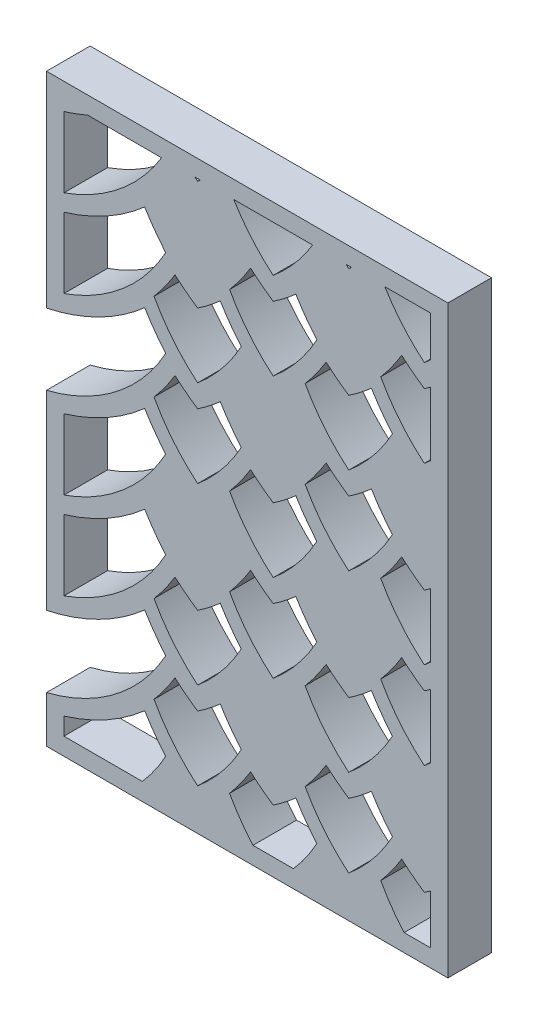
from build123d import *

# Parameters (mm, degrees)
SKETCH3_W           = 44
SKETCH3_H           = 63
BOSS_EXTRUDE1_DEPTH = 5
CUT_EXTRUDE2_DEPTH  = 97.338494284
SKETCH4_W           = 44
SKETCH4_H           = 2
BOSS_EXTRUDE2_DEPTH = 5
SKETCH5_W           = 2
SKETCH5_H           = 3.648110673
SKETCH5_H_2         = 19.321036692
SKETCH5_H_3         = 20.040143185
BOSS_EXTRUDE3_DEPTH = 5


with BuildPart() as part:
    # Sketch3 → Boss-Extrude1 (new body)
    with BuildSketch(Plane.XY):
        with Locations((22, 54.057614979)):
            Rectangle(SKETCH3_W, SKETCH3_H)
    extrude(amount=BOSS_EXTRUDE1_DEPTH)

    # Sketch2 → Cut-Extrude2 (cut, through all)
    with BuildSketch(Plane.XY):
        with BuildLine():
            ThreePointArc((17.320508076, 5.287997478), (14.53811499, 8.101888513), (12.320449347, 11.379334643))
            ThreePointArc((12.320449347, 11.379334643), (13.592770843, 12.995597857), (14.726377387, 14.712002522))
            ThreePointArc((14.726377387, 14.712002522), (15.990223335, 13.667427809), (17.320508076, 12.708894857))
            ThreePointArc((17.320508076, 12.708894857), (18.650792816, 13.667427809), (19.914638764, 14.712002522))
            ThreePointArc((19.914638764, 14.712002522), (21.048245308, 12.995597857), (22.320566805, 11.379334643))
            ThreePointArc((22.320566805, 11.379334643), (20.102901162, 8.101888513), (17.320508076, 5.287997478))
        make_face()
        with BuildLine():
            ThreePointArc((25.980762114, 10.287997478), (23.198369028, 13.101888513), (20.980703384, 16.379334643))
            ThreePointArc((20.980703384, 16.379334643), (22.253024881, 17.995597857), (23.386631425, 19.712002522))
            ThreePointArc((23.386631425, 19.712002522), (24.650477373, 18.667427809), (25.980762114, 17.708894857))
            ThreePointArc((25.980762114, 17.708894857), (27.311046854, 18.667427809), (28.574892802, 19.712002522))
            ThreePointArc((28.574892802, 19.712002522), (29.708499346, 17.995597857), (30.980820843, 16.379334643))
            ThreePointArc((30.980820843, 16.379334643), (28.763155199, 13.101888513), (25.980762114, 10.287997478))
        make_face()
        with BuildLine():
            ThreePointArc((43.301270189, 20.287997478), (40.518877103, 23.101888513), (38.30121146, 26.379334643))
            ThreePointArc((38.30121146, 26.379334643), (39.573532957, 27.995597857), (40.7071395, 29.712002522))
            ThreePointArc((40.7071395, 29.712002522), (41.970985448, 28.667427809), (43.301270189, 27.708894857))
            ThreePointArc((43.301270189, 27.708894857), (44.63155493, 28.667427809), (45.895400878, 29.712002522))
            ThreePointArc((45.895400878, 29.712002522), (47.029007421, 27.995597857), (48.301328918, 26.379334643))
            ThreePointArc((48.301328918, 26.379334643), (46.083663275, 23.101888513), (43.301270189, 20.287997478))
        make_face()
        with BuildLine():
            ThreePointArc((51.961524227, 25.287997478), (49.179131141, 28.101888513), (46.961465498, 31.379334643))
            ThreePointArc((46.961465498, 31.379334643), (48.233786995, 32.995597857), (49.367393538, 34.712002522))
            ThreePointArc((49.367393538, 34.712002522), (50.631239486, 33.667427809), (51.961524227, 32.708894857))
            ThreePointArc((51.961524227, 32.708894857), (53.291808968, 33.667427809), (54.555654916, 34.712002522))
            ThreePointArc((54.555654916, 34.712002522), (55.689261459, 32.995597857), (56.961582956, 31.379334643))
            ThreePointArc((56.961582956, 31.379334643), (54.743917313, 28.101888513), (51.961524227, 25.287997478))
        make_face()
        with BuildLine():
            ThreePointArc((25.980762114, 20.287997478), (23.198369028, 23.101888513), (20.980703384, 26.379334643))
            ThreePointArc((20.980703384, 26.379334643), (22.253024881, 27.995597857), (23.386631425, 29.712002522))
            ThreePointArc((23.386631425, 29.712002522), (24.650477373, 28.667427809), (25.980762114, 27.708894857))
            ThreePointArc((25.980762114, 27.708894857), (27.311046854, 28.667427809), (28.574892802, 29.712002522))
            ThreePointArc((28.574892802, 29.712002522), (29.708499346, 27.995597857), (30.980820843, 26.379334643))
            ThreePointArc((30.980820843, 26.379334643), (28.763155199, 23.101888513), (25.980762114, 20.287997478))
        make_face()
        with BuildLine():
            ThreePointArc((34.641016151, 25.287997478), (31.858623065, 28.101888513), (29.640957422, 31.379334643))
            ThreePointArc((29.640957422, 31.379334643), (30.913278919, 32.995597857), (32.046885463, 34.712002522))
            ThreePointArc((32.046885463, 34.712002522), (33.310731411, 33.667427809), (34.641016151, 32.708894857))
            ThreePointArc((34.641016151, 32.708894857), (35.971300892, 33.667427809), (37.23514684, 34.712002522))
            ThreePointArc((37.23514684, 34.712002522), (38.368753384, 32.995597857), (39.64107488, 31.379334643))
            ThreePointArc((39.64107488, 31.379334643), (37.423409237, 28.101888513), (34.641016151, 25.287997478))
        make_face()
        with BuildLine():
            ThreePointArc((51.961524227, 35.287997478), (49.179131141, 38.101888513), (46.961465498, 41.379334643))
            ThreePointArc((46.961465498, 41.379334643), (48.233786995, 42.995597857), (49.367393538, 44.712002522))
            ThreePointArc((49.367393538, 44.712002522), (50.631239486, 43.667427809), (51.961524227, 42.708894857))
            ThreePointArc((51.961524227, 42.708894857), (53.291808968, 43.667427809), (54.555654916, 44.712002522))
            ThreePointArc((54.555654916, 44.712002522), (55.689261459, 42.995597857), (56.961582956, 41.379334643))
            ThreePointArc((56.961582956, 41.379334643), (54.743917313, 38.101888513), (51.961524227, 35.287997478))
        make_face()
        with BuildLine():
            ThreePointArc((60.621778265, 40.287997478), (57.839385179, 43.101888513), (55.621719536, 46.379334643))
            ThreePointArc((55.621719536, 46.379334643), (56.894041033, 47.995597857), (58.027647576, 49.712002522))
            ThreePointArc((58.027647576, 49.712002522), (59.291493524, 48.667427809), (60.621778265, 47.708894857))
            ThreePointArc((60.621778265, 47.708894857), (61.952063006, 48.667427809), (63.215908954, 49.712002522))
            ThreePointArc((63.215908954, 49.712002522), (64.349515497, 47.995597857), (65.621836994, 46.379334643))
            ThreePointArc((65.621836994, 46.379334643), (63.404171351, 43.101888513), (60.621778265, 40.287997478))
        make_face()
        with BuildLine():
            ThreePointArc((17.320508076, 25.287997478), (14.53811499, 28.101888513), (12.320449347, 31.379334643))
            ThreePointArc((12.320449347, 31.379334643), (13.592770843, 32.995597857), (14.726377387, 34.712002522))
            ThreePointArc((14.726377387, 34.712002522), (15.990223335, 33.667427809), (17.320508076, 32.708894857))
            ThreePointArc((17.320508076, 32.708894857), (18.650792816, 33.667427809), (19.914638764, 34.712002522))
            ThreePointArc((19.914638764, 34.712002522), (21.048245308, 32.995597857), (22.320566805, 31.379334643))
            ThreePointArc((22.320566805, 31.379334643), (20.102901162, 28.101888513), (17.320508076, 25.287997478))
        make_face()
        with BuildLine():
            ThreePointArc((34.641016151, 35.287997478), (31.858623065, 38.101888513), (29.640957422, 41.379334643))
            ThreePointArc((29.640957422, 41.379334643), (30.913278919, 42.995597857), (32.046885463, 44.712002522))
            ThreePointArc((32.046885463, 44.712002522), (33.310731411, 43.667427809), (34.641016151, 42.708894857))
            ThreePointArc((34.641016151, 42.708894857), (35.971300892, 43.667427809), (37.23514684, 44.712002522))
            ThreePointArc((37.23514684, 44.712002522), (38.368753384, 42.995597857), (39.64107488, 41.379334643))
            ThreePointArc((39.64107488, 41.379334643), (37.423409237, 38.101888513), (34.641016151, 35.287997478))
        make_face()
        with BuildLine():
            ThreePointArc((43.301270189, 40.287997478), (40.518877103, 43.101888513), (38.30121146, 46.379334643))
            ThreePointArc((38.30121146, 46.379334643), (39.573532957, 47.995597857), (40.7071395, 49.712002522))
            ThreePointArc((40.7071395, 49.712002522), (41.970985448, 48.667427809), (43.301270189, 47.708894857))
            ThreePointArc((43.301270189, 47.708894857), (44.63155493, 48.667427809), (45.895400878, 49.712002522))
            ThreePointArc((45.895400878, 49.712002522), (47.029007421, 47.995597857), (48.301328918, 46.379334643))
            ThreePointArc((48.301328918, 46.379334643), (46.083663275, 43.101888513), (43.301270189, 40.287997478))
        make_face()
        with BuildLine():
            ThreePointArc((60.621778265, 50.287997478), (57.839385179, 53.101888513), (55.621719536, 56.379334643))
            ThreePointArc((55.621719536, 56.379334643), (56.894041033, 57.995597857), (58.027647576, 59.712002522))
            ThreePointArc((58.027647576, 59.712002522), (59.291493524, 58.667427809), (60.621778265, 57.708894857))
            ThreePointArc((60.621778265, 57.708894857), (61.952063006, 58.667427809), (63.215908954, 59.712002522))
            ThreePointArc((63.215908954, 59.712002522), (64.349515497, 57.995597857), (65.621836994, 56.379334643))
            ThreePointArc((65.621836994, 56.379334643), (63.404171351, 53.101888513), (60.621778265, 50.287997478))
        make_face()
        with BuildLine():
            ThreePointArc((17.320508076, 35.287997478), (14.53811499, 38.101888513), (12.320449347, 41.379334643))
            ThreePointArc((12.320449347, 41.379334643), (13.592770843, 42.995597857), (14.726377387, 44.712002522))
            ThreePointArc((14.726377387, 44.712002522), (15.990223335, 43.667427809), (17.320508076, 42.708894857))
            ThreePointArc((17.320508076, 42.708894857), (18.650792816, 43.667427809), (19.914638764, 44.712002522))
            ThreePointArc((19.914638764, 44.712002522), (21.048245308, 42.995597857), (22.320566805, 41.379334643))
            ThreePointArc((22.320566805, 41.379334643), (20.102901162, 38.101888513), (17.320508076, 35.287997478))
        make_face()
        with BuildLine():
            ThreePointArc((25.980762114, 40.287997478), (23.198369028, 43.101888513), (20.980703384, 46.379334643))
            ThreePointArc((20.980703384, 46.379334643), (22.253024881, 47.995597857), (23.386631425, 49.712002522))
            ThreePointArc((23.386631425, 49.712002522), (24.650477373, 48.667427809), (25.980762114, 47.708894857))
            ThreePointArc((25.980762114, 47.708894857), (27.311046854, 48.667427809), (28.574892802, 49.712002522))
            ThreePointArc((28.574892802, 49.712002522), (29.708499346, 47.995597857), (30.980820843, 46.379334643))
            ThreePointArc((30.980820843, 46.379334643), (28.763155199, 43.101888513), (25.980762114, 40.287997478))
        make_face()
        with BuildLine():
            ThreePointArc((43.301270189, 50.287997478), (40.518877103, 53.101888513), (38.30121146, 56.379334643))
            ThreePointArc((38.30121146, 56.379334643), (39.573532957, 57.995597857), (40.7071395, 59.712002522))
            ThreePointArc((40.7071395, 59.712002522), (41.970985448, 58.667427809), (43.301270189, 57.708894857))
            ThreePointArc((43.301270189, 57.708894857), (44.63155493, 58.667427809), (45.895400878, 59.712002522))
            ThreePointArc((45.895400878, 59.712002522), (47.029007421, 57.995597857), (48.301328918, 56.379334643))
            ThreePointArc((48.301328918, 56.379334643), (46.083663275, 53.101888513), (43.301270189, 50.287997478))
        make_face()
        with BuildLine():
            ThreePointArc((51.961524227, 55.287997478), (49.179131141, 58.101888513), (46.961465498, 61.379334643))
            ThreePointArc((46.961465498, 61.379334643), (48.233786995, 62.995597857), (49.367393538, 64.712002522))
            ThreePointArc((49.367393538, 64.712002522), (50.631239486, 63.667427809), (51.961524227, 62.708894857))
            ThreePointArc((51.961524227, 62.708894857), (53.291808968, 63.667427809), (54.555654916, 64.712002522))
            ThreePointArc((54.555654916, 64.712002522), (55.689261459, 62.995597857), (56.961582956, 61.379334643))
            ThreePointArc((56.961582956, 61.379334643), (54.743917313, 58.101888513), (51.961524227, 55.287997478))
        make_face()
        with BuildLine():
            ThreePointArc((25.980762114, 50.287997478), (23.198369028, 53.101888513), (20.980703384, 56.379334643))
            ThreePointArc((20.980703384, 56.379334643), (22.253024881, 57.995597857), (23.386631425, 59.712002522))
            ThreePointArc((23.386631425, 59.712002522), (24.650477373, 58.667427809), (25.980762114, 57.708894857))
            ThreePointArc((25.980762114, 57.708894857), (27.311046854, 58.667427809), (28.574892802, 59.712002522))
            ThreePointArc((28.574892802, 59.712002522), (29.708499346, 57.995597857), (30.980820843, 56.379334643))
            ThreePointArc((30.980820843, 56.379334643), (28.763155199, 53.101888513), (25.980762114, 50.287997478))
        make_face()
        with BuildLine():
            ThreePointArc((34.641016151, 55.287997478), (31.858623065, 58.101888513), (29.640957422, 61.379334643))
            ThreePointArc((29.640957422, 61.379334643), (30.913278919, 62.995597857), (32.046885463, 64.712002522))
            ThreePointArc((32.046885463, 64.712002522), (33.310731411, 63.667427809), (34.641016151, 62.708894857))
            ThreePointArc((34.641016151, 62.708894857), (35.971300892, 63.667427809), (37.23514684, 64.712002522))
            ThreePointArc((37.23514684, 64.712002522), (38.368753384, 62.995597857), (39.64107488, 61.379334643))
            ThreePointArc((39.64107488, 61.379334643), (37.423409237, 58.101888513), (34.641016151, 55.287997478))
        make_face()
        with BuildLine():
            ThreePointArc((51.961524227, 65.287997478), (49.179131141, 68.101888513), (46.961465498, 71.379334643))
            ThreePointArc((46.961465498, 71.379334643), (48.233786995, 72.995597857), (49.367393538, 74.712002522))
            ThreePointArc((49.367393538, 74.712002522), (50.631239486, 73.667427809), (51.961524227, 72.708894857))
            ThreePointArc((51.961524227, 72.708894857), (53.291808968, 73.667427809), (54.555654916, 74.712002522))
            ThreePointArc((54.555654916, 74.712002522), (55.689261459, 72.995597857), (56.961582956, 71.379334643))
            ThreePointArc((56.961582956, 71.379334643), (54.743917313, 68.101888513), (51.961524227, 65.287997478))
        make_face()
        with BuildLine():
            ThreePointArc((60.621778265, 70.287997478), (57.839385179, 73.101888513), (55.621719536, 76.379334643))
            ThreePointArc((55.621719536, 76.379334643), (56.894041033, 77.995597857), (58.027647576, 79.712002522))
            ThreePointArc((58.027647576, 79.712002522), (59.291493524, 78.667427809), (60.621778265, 77.708894857))
            ThreePointArc((60.621778265, 77.708894857), (61.952063006, 78.667427809), (63.215908954, 79.712002522))
            ThreePointArc((63.215908954, 79.712002522), (64.349515497, 77.995597857), (65.621836994, 76.379334643))
            ThreePointArc((65.621836994, 76.379334643), (63.404171351, 73.101888513), (60.621778265, 70.287997478))
        make_face()
        with BuildLine():
            ThreePointArc((17.320508076, 55.287997478), (14.53811499, 58.101888513), (12.320449347, 61.379334643))
            ThreePointArc((12.320449347, 61.379334643), (13.592770843, 62.995597857), (14.726377387, 64.712002522))
            ThreePointArc((14.726377387, 64.712002522), (15.990223335, 63.667427809), (17.320508076, 62.708894857))
            ThreePointArc((17.320508076, 62.708894857), (18.650792816, 63.667427809), (19.914638764, 64.712002522))
            ThreePointArc((19.914638764, 64.712002522), (21.048245308, 62.995597857), (22.320566805, 61.379334643))
            ThreePointArc((22.320566805, 61.379334643), (20.102901162, 58.101888513), (17.320508076, 55.287997478))
        make_face()
        with BuildLine():
            ThreePointArc((34.641016151, 65.287997478), (31.858623065, 68.101888513), (29.640957422, 71.379334643))
            ThreePointArc((29.640957422, 71.379334643), (30.913278919, 72.995597857), (32.046885463, 74.712002522))
            ThreePointArc((32.046885463, 74.712002522), (33.310731411, 73.667427809), (34.641016151, 72.708894857))
            ThreePointArc((34.641016151, 72.708894857), (35.971300892, 73.667427809), (37.23514684, 74.712002522))
            ThreePointArc((37.23514684, 74.712002522), (38.368753384, 72.995597857), (39.64107488, 71.379334643))
            ThreePointArc((39.64107488, 71.379334643), (37.423409237, 68.101888513), (34.641016151, 65.287997478))
        make_face()
        with BuildLine():
            ThreePointArc((43.301270189, 70.287997478), (40.518877103, 73.101888513), (38.30121146, 76.379334643))
            ThreePointArc((38.30121146, 76.379334643), (39.573532957, 77.995597857), (40.7071395, 79.712002522))
            ThreePointArc((40.7071395, 79.712002522), (41.970985448, 78.667427809), (43.301270189, 77.708894857))
            ThreePointArc((43.301270189, 77.708894857), (44.63155493, 78.667427809), (45.895400878, 79.712002522))
            ThreePointArc((45.895400878, 79.712002522), (47.029007421, 77.995597857), (48.301328918, 76.379334643))
            ThreePointArc((48.301328918, 76.379334643), (46.083663275, 73.101888513), (43.301270189, 70.287997478))
        make_face()
        with BuildLine():
            ThreePointArc((60.621778265, 80.287997478), (57.839385179, 83.101888513), (55.621719536, 86.379334643))
            ThreePointArc((55.621719536, 86.379334643), (56.894041033, 87.995597857), (58.027647576, 89.712002522))
            ThreePointArc((58.027647576, 89.712002522), (59.291493524, 88.667427809), (60.621778265, 87.708894857))
            ThreePointArc((60.621778265, 87.708894857), (61.952063006, 88.667427809), (63.215908954, 89.712002522))
            ThreePointArc((63.215908954, 89.712002522), (64.349515497, 87.995597857), (65.621836994, 86.379334643))
            ThreePointArc((65.621836994, 86.379334643), (63.404171351, 83.101888513), (60.621778265, 80.287997478))
        make_face()
        with BuildLine():
            ThreePointArc((17.320508076, 65.287997478), (14.53811499, 68.101888513), (12.320449347, 71.379334643))
            ThreePointArc((12.320449347, 71.379334643), (13.592770843, 72.995597857), (14.726377387, 74.712002522))
            ThreePointArc((14.726377387, 74.712002522), (15.990223335, 73.667427809), (17.320508076, 72.708894857))
            ThreePointArc((17.320508076, 72.708894857), (18.650792816, 73.667427809), (19.914638764, 74.712002522))
            ThreePointArc((19.914638764, 74.712002522), (21.048245308, 72.995597857), (22.320566805, 71.379334643))
            ThreePointArc((22.320566805, 71.379334643), (20.102901162, 68.101888513), (17.320508076, 65.287997478))
        make_face()
        with BuildLine():
            ThreePointArc((25.980762114, 70.287997478), (23.198369028, 73.101888513), (20.980703384, 76.379334643))
            ThreePointArc((20.980703384, 76.379334643), (22.253024881, 77.995597857), (23.386631425, 79.712002522))
            ThreePointArc((23.386631425, 79.712002522), (24.650477373, 78.667427809), (25.980762114, 77.708894857))
            ThreePointArc((25.980762114, 77.708894857), (27.311046854, 78.667427809), (28.574892802, 79.712002522))
            ThreePointArc((28.574892802, 79.712002522), (29.708499346, 77.995597857), (30.980820843, 76.379334643))
            ThreePointArc((30.980820843, 76.379334643), (28.763155199, 73.101888513), (25.980762114, 70.287997478))
        make_face()
        with BuildLine():
            ThreePointArc((43.301270189, 80.287997478), (40.518877103, 83.101888513), (38.30121146, 86.379334643))
            ThreePointArc((38.30121146, 86.379334643), (39.573532957, 87.995597857), (40.7071395, 89.712002522))
            ThreePointArc((40.7071395, 89.712002522), (41.970985448, 88.667427809), (43.301270189, 87.708894857))
            ThreePointArc((43.301270189, 87.708894857), (44.63155493, 88.667427809), (45.895400878, 89.712002522))
            ThreePointArc((45.895400878, 89.712002522), (47.029007421, 87.995597857), (48.301328918, 86.379334643))
            ThreePointArc((48.301328918, 86.379334643), (46.083663275, 83.101888513), (43.301270189, 80.287997478))
        make_face()
        with BuildLine():
            ThreePointArc((51.961524227, 85.287997478), (49.179131141, 88.101888513), (46.961465498, 91.379334643))
            ThreePointArc((46.961465498, 91.379334643), (48.233786995, 92.995597857), (49.367393538, 94.712002522))
            ThreePointArc((49.367393538, 94.712002522), (50.631239486, 93.667427809), (51.961524227, 92.708894857))
            ThreePointArc((51.961524227, 92.708894857), (53.291808968, 93.667427809), (54.555654916, 94.712002522))
            ThreePointArc((54.555654916, 94.712002522), (55.689261459, 92.995597857), (56.961582956, 91.379334643))
            ThreePointArc((56.961582956, 91.379334643), (54.743917313, 88.101888513), (51.961524227, 85.287997478))
        make_face()
        with BuildLine():
            ThreePointArc((25.980762114, 80.287997478), (23.198369028, 83.101888513), (20.980703384, 86.379334643))
            ThreePointArc((20.980703384, 86.379334643), (22.253024881, 87.995597857), (23.386631425, 89.712002522))
            ThreePointArc((23.386631425, 89.712002522), (24.650477373, 88.667427809), (25.980762114, 87.708894857))
            ThreePointArc((25.980762114, 87.708894857), (27.311046854, 88.667427809), (28.574892802, 89.712002522))
            ThreePointArc((28.574892802, 89.712002522), (29.708499346, 87.995597857), (30.980820843, 86.379334643))
            ThreePointArc((30.980820843, 86.379334643), (28.763155199, 83.101888513), (25.980762114, 80.287997478))
        make_face()
        with BuildLine():
            ThreePointArc((34.641016151, 85.287997478), (31.858623065, 88.101888513), (29.640957422, 91.379334643))
            ThreePointArc((29.640957422, 91.379334643), (30.913278919, 92.995597857), (32.046885463, 94.712002522))
            ThreePointArc((32.046885463, 94.712002522), (33.310731411, 93.667427809), (34.641016151, 92.708894857))
            ThreePointArc((34.641016151, 92.708894857), (35.971300892, 93.667427809), (37.23514684, 94.712002522))
            ThreePointArc((37.23514684, 94.712002522), (38.368753384, 92.995597857), (39.64107488, 91.379334643))
            ThreePointArc((39.64107488, 91.379334643), (37.423409237, 88.101888513), (34.641016151, 85.287997478))
        make_face()
        with BuildLine():
            ThreePointArc((51.961524227, 95.287997478), (49.179131141, 98.101888513), (46.961465498, 101.379334643))
            ThreePointArc((46.961465498, 101.379334643), (48.233786995, 102.995597857), (49.367393538, 104.712002522))
            ThreePointArc((49.367393538, 104.712002522), (50.631239486, 103.667427809), (51.961524227, 102.708894857))
            ThreePointArc((51.961524227, 102.708894857), (53.291808968, 103.667427809), (54.555654916, 104.712002522))
            ThreePointArc((54.555654916, 104.712002522), (55.689261459, 102.995597857), (56.961582956, 101.379334643))
            ThreePointArc((56.961582956, 101.379334643), (54.743917313, 98.101888513), (51.961524227, 95.287997478))
        make_face()
        with BuildLine():
            ThreePointArc((60.621778265, 100.287997478), (57.839385179, 103.101888513), (55.621719536, 106.379334643))
            ThreePointArc((55.621719536, 106.379334643), (56.894041033, 107.995597857), (58.027647576, 109.712002522))
            ThreePointArc((58.027647576, 109.712002522), (59.291493524, 108.667427809), (60.621778265, 107.708894857))
            ThreePointArc((60.621778265, 107.708894857), (61.952063006, 108.667427809), (63.215908954, 109.712002522))
            ThreePointArc((63.215908954, 109.712002522), (64.349515497, 107.995597857), (65.621836994, 106.379334643))
            ThreePointArc((65.621836994, 106.379334643), (63.404171351, 103.101888513), (60.621778265, 100.287997478))
        make_face()
        with BuildLine():
            ThreePointArc((17.320508076, 85.287997478), (14.53811499, 88.101888513), (12.320449347, 91.379334643))
            ThreePointArc((12.320449347, 91.379334643), (13.592770843, 92.995597857), (14.726377387, 94.712002522))
            ThreePointArc((14.726377387, 94.712002522), (15.990223335, 93.667427809), (17.320508076, 92.708894857))
            ThreePointArc((17.320508076, 92.708894857), (18.650792816, 93.667427809), (19.914638764, 94.712002522))
            ThreePointArc((19.914638764, 94.712002522), (21.048245308, 92.995597857), (22.320566805, 91.379334643))
            ThreePointArc((22.320566805, 91.379334643), (20.102901162, 88.101888513), (17.320508076, 85.287997478))
        make_face()
        with BuildLine():
            ThreePointArc((34.641016151, 95.287997478), (31.858623065, 98.101888513), (29.640957422, 101.379334643))
            ThreePointArc((29.640957422, 101.379334643), (30.913278919, 102.995597857), (32.046885463, 104.712002522))
            ThreePointArc((32.046885463, 104.712002522), (33.310731411, 103.667427809), (34.641016151, 102.708894857))
            ThreePointArc((34.641016151, 102.708894857), (35.971300892, 103.667427809), (37.23514684, 104.712002522))
            ThreePointArc((37.23514684, 104.712002522), (38.368753384, 102.995597857), (39.64107488, 101.379334643))
            ThreePointArc((39.64107488, 101.379334643), (37.423409237, 98.101888513), (34.641016151, 95.287997478))
        make_face()
        with BuildLine():
            ThreePointArc((43.301270189, 100.287997478), (40.518877103, 103.101888513), (38.30121146, 106.379334643))
            ThreePointArc((38.30121146, 106.379334643), (39.573532957, 107.995597857), (40.7071395, 109.712002522))
            ThreePointArc((40.7071395, 109.712002522), (41.970985448, 108.667427809), (43.301270189, 107.708894857))
            ThreePointArc((43.301270189, 107.708894857), (44.63155493, 108.667427809), (45.895400878, 109.712002522))
            ThreePointArc((45.895400878, 109.712002522), (47.029007421, 107.995597857), (48.301328918, 106.379334643))
            ThreePointArc((48.301328918, 106.379334643), (46.083663275, 103.101888513), (43.301270189, 100.287997478))
        make_face()
        with BuildLine():
            ThreePointArc((60.621778265, 110.287997478), (57.839385179, 113.101888513), (55.621719536, 116.379334643))
            ThreePointArc((55.621719536, 116.379334643), (56.894041033, 117.995597857), (58.027647576, 119.712002522))
            ThreePointArc((58.027647576, 119.712002522), (59.291493524, 118.667427809), (60.621778265, 117.708894857))
            ThreePointArc((60.621778265, 117.708894857), (61.952063006, 118.667427809), (63.215908954, 119.712002522))
            ThreePointArc((63.215908954, 119.712002522), (64.349515497, 117.995597857), (65.621836994, 116.379334643))
            ThreePointArc((65.621836994, 116.379334643), (63.404171351, 113.101888513), (60.621778265, 110.287997478))
        make_face()
        with BuildLine():
            ThreePointArc((8.660254038, 97.708894857), (9.990538779, 98.667427809), (11.254384727, 99.712002522))
            ThreePointArc((11.254384727, 99.712002522), (12.38799127, 97.995597857), (13.660312767, 96.379334643))
            ThreePointArc((13.660312767, 96.379334643), (11.442647124, 93.101888513), (8.660254038, 90.287997478))
            ThreePointArc((8.660254038, 90.287997478), (4.5826158, 87.591384087), (0, 85.888888917))
            ThreePointArc((0, 85.888888917), (-4.5826158, 87.591384087), (-8.660254038, 90.287997478))
            ThreePointArc((-8.660254038, 90.287997478), (-11.442647124, 93.101888513), (-13.660312767, 96.379334643))
            ThreePointArc((-13.660312767, 96.379334643), (-12.38799127, 97.995597857), (-11.254384727, 99.712002522))
            ThreePointArc((-11.254384727, 99.712002522), (-9.990538779, 98.667427809), (-8.660254038, 97.708894857))
            ThreePointArc((-8.660254038, 97.708894857), (-4.505719757, 95.462944418), (0, 94.047692517))
            ThreePointArc((0, 94.047692517), (4.505719757, 95.462944418), (8.660254038, 97.708894857))
        make_face()
        with BuildLine():
            ThreePointArc((17.320508076, 95.287997478), (14.53811499, 98.101888513), (12.320449347, 101.379334643))
            ThreePointArc((12.320449347, 101.379334643), (13.592770843, 102.995597857), (14.726377387, 104.712002522))
            ThreePointArc((14.726377387, 104.712002522), (15.990223335, 103.667427809), (17.320508076, 102.708894857))
            ThreePointArc((17.320508076, 102.708894857), (18.650792816, 103.667427809), (19.914638764, 104.712002522))
            ThreePointArc((19.914638764, 104.712002522), (21.048245308, 102.995597857), (22.320566805, 101.379334643))
            ThreePointArc((22.320566805, 101.379334643), (20.102901162, 98.101888513), (17.320508076, 95.287997478))
        make_face()
        with BuildLine():
            ThreePointArc((25.980762114, 100.287997478), (23.198369028, 103.101888513), (20.980703384, 106.379334643))
            ThreePointArc((20.980703384, 106.379334643), (22.253024881, 107.995597857), (23.386631425, 109.712002522))
            ThreePointArc((23.386631425, 109.712002522), (24.650477373, 108.667427809), (25.980762114, 107.708894857))
            ThreePointArc((25.980762114, 107.708894857), (27.311046854, 108.667427809), (28.574892802, 109.712002522))
            ThreePointArc((28.574892802, 109.712002522), (29.708499346, 107.995597857), (30.980820843, 106.379334643))
            ThreePointArc((30.980820843, 106.379334643), (28.763155199, 103.101888513), (25.980762114, 100.287997478))
        make_face()
        with BuildLine():
            ThreePointArc((43.301270189, 110.287997478), (40.518877103, 113.101888513), (38.30121146, 116.379334643))
            ThreePointArc((38.30121146, 116.379334643), (39.573532957, 117.995597857), (40.7071395, 119.712002522))
            ThreePointArc((40.7071395, 119.712002522), (41.970985448, 118.667427809), (43.301270189, 117.708894857))
            ThreePointArc((43.301270189, 117.708894857), (44.63155493, 118.667427809), (45.895400878, 119.712002522))
            ThreePointArc((45.895400878, 119.712002522), (47.029007421, 117.995597857), (48.301328918, 116.379334643))
            ThreePointArc((48.301328918, 116.379334643), (46.083663275, 113.101888513), (43.301270189, 110.287997478))
        make_face()
        with BuildLine():
            ThreePointArc((51.961524227, 115.287997478), (49.179131141, 118.101888513), (46.961465498, 121.379334643))
            ThreePointArc((46.961465498, 121.379334643), (48.233786995, 122.995597857), (49.367393538, 124.712002522))
            ThreePointArc((49.367393538, 124.712002522), (50.631239486, 123.667427809), (51.961524227, 122.708894857))
            ThreePointArc((51.961524227, 122.708894857), (53.291808968, 123.667427809), (54.555654916, 124.712002522))
            ThreePointArc((54.555654916, 124.712002522), (55.689261459, 122.995597857), (56.961582956, 121.379334643))
            ThreePointArc((56.961582956, 121.379334643), (54.743917313, 118.101888513), (51.961524227, 115.287997478))
        make_face()
        with BuildLine():
            ThreePointArc((0, 5.287997478), (-2.782393086, 8.101888513), (-5.000058729, 11.379334643))
            ThreePointArc((-5.000058729, 11.379334643), (-3.727737232, 12.995597857), (-2.594130689, 14.712002522))
            ThreePointArc((-2.594130689, 14.712002522), (-1.330284741, 13.667427809), (0, 12.708894857))
            ThreePointArc((0, 12.708894857), (1.330284741, 13.667427809), (2.594130689, 14.712002522))
            ThreePointArc((2.594130689, 14.712002522), (3.727737232, 12.995597857), (5.000058729, 11.379334643))
            ThreePointArc((5.000058729, 11.379334643), (2.782393086, 8.101888513), (0, 5.287997478))
        make_face()
        with BuildLine():
            ThreePointArc((-13.660312767, 86.379334643), (-12.38799127, 87.995597857), (-11.254384727, 89.712002522))
            ThreePointArc((-11.254384727, 89.712002522), (-9.990538779, 88.667427809), (-8.660254038, 87.708894857))
            ThreePointArc((-8.660254038, 87.708894857), (-4.505719757, 85.462944418), (0, 84.047692517))
            ThreePointArc((0, 84.047692517), (4.505719757, 85.462944418), (8.660254038, 87.708894857))
            ThreePointArc((8.660254038, 87.708894857), (9.990538779, 88.667427809), (11.254384727, 89.712002522))
            ThreePointArc((11.254384727, 89.712002522), (12.38799127, 87.995597857), (13.660312767, 86.379334643))
            ThreePointArc((13.660312767, 86.379334643), (11.442647124, 83.101888513), (8.660254038, 80.287997478))
            ThreePointArc((8.660254038, 80.287997478), (4.5826158, 77.591384087), (0, 75.888888917))
            ThreePointArc((0, 75.888888917), (-4.5826158, 77.591384087), (-8.660254038, 80.287997478))
            ThreePointArc((-8.660254038, 80.287997478), (-11.442647124, 83.101888513), (-13.660312767, 86.379334643))
        make_face()
        with BuildLine():
            ThreePointArc((-13.660312767, 76.379334643), (-12.38799127, 77.995597857), (-11.254384727, 79.712002522))
            ThreePointArc((-11.254384727, 79.712002522), (-9.990538779, 78.667427809), (-8.660254038, 77.708894857))
            ThreePointArc((-8.660254038, 77.708894857), (-4.505719757, 75.462944418), (0, 74.047692517))
            ThreePointArc((0, 74.047692517), (4.505719757, 75.462944418), (8.660254038, 77.708894857))
            ThreePointArc((8.660254038, 77.708894857), (9.990538779, 78.667427809), (11.254384727, 79.712002522))
            ThreePointArc((11.254384727, 79.712002522), (12.38799127, 77.995597857), (13.660312767, 76.379334643))
            ThreePointArc((13.660312767, 76.379334643), (11.442647124, 73.101888513), (8.660254038, 70.287997478))
            ThreePointArc((8.660254038, 70.287997478), (4.5826158, 67.591384087), (0, 65.888888917))
            ThreePointArc((0, 65.888888917), (-4.5826158, 67.591384087), (-8.660254038, 70.287997478))
            ThreePointArc((-8.660254038, 70.287997478), (-11.442647124, 73.101888513), (-13.660312767, 76.379334643))
        make_face()
        with BuildLine():
            ThreePointArc((-13.660312767, 66.379334643), (-12.38799127, 67.995597857), (-11.254384727, 69.712002522))
            ThreePointArc((-11.254384727, 69.712002522), (-9.990538779, 68.667427809), (-8.660254038, 67.708894857))
            ThreePointArc((-8.660254038, 67.708894857), (-4.505719757, 65.462944418), (0, 64.047692517))
            ThreePointArc((0, 64.047692517), (4.505719757, 65.462944418), (8.660254038, 67.708894857))
            ThreePointArc((8.660254038, 67.708894857), (9.990538779, 68.667427809), (11.254384727, 69.712002522))
            ThreePointArc((11.254384727, 69.712002522), (12.38799127, 67.995597857), (13.660312767, 66.379334643))
            ThreePointArc((13.660312767, 66.379334643), (11.442647124, 63.101888513), (8.660254038, 60.287997478))
            ThreePointArc((8.660254038, 60.287997478), (4.5826158, 57.591384087), (0, 55.888888917))
            ThreePointArc((0, 55.888888917), (-4.5826158, 57.591384087), (-8.660254038, 60.287997478))
            ThreePointArc((-8.660254038, 60.287997478), (-11.442647124, 63.101888513), (-13.660312767, 66.379334643))
        make_face()
        with BuildLine():
            ThreePointArc((-13.660312767, 56.379334643), (-12.38799127, 57.995597857), (-11.254384727, 59.712002522))
            ThreePointArc((-11.254384727, 59.712002522), (-9.990538779, 58.667427809), (-8.660254038, 57.708894857))
            ThreePointArc((-8.660254038, 57.708894857), (-4.505719757, 55.462944418), (0, 54.047692517))
            ThreePointArc((0, 54.047692517), (4.505719757, 55.462944418), (8.660254038, 57.708894857))
            ThreePointArc((8.660254038, 57.708894857), (9.990538779, 58.667427809), (11.254384727, 59.712002522))
            ThreePointArc((11.254384727, 59.712002522), (12.38799127, 57.995597857), (13.660312767, 56.379334643))
            ThreePointArc((13.660312767, 56.379334643), (11.442647124, 53.101888513), (8.660254038, 50.287997478))
            ThreePointArc((8.660254038, 50.287997478), (4.5826158, 47.591384087), (0, 45.888888917))
            ThreePointArc((0, 45.888888917), (-4.5826158, 47.591384087), (-8.660254038, 50.287997478))
            ThreePointArc((-8.660254038, 50.287997478), (-11.442647124, 53.101888513), (-13.660312767, 56.379334643))
        make_face()
        with BuildLine():
            ThreePointArc((-13.660312767, 46.379334643), (-12.38799127, 47.995597857), (-11.254384727, 49.712002522))
            ThreePointArc((-11.254384727, 49.712002522), (-9.990538779, 48.667427809), (-8.660254038, 47.708894857))
            ThreePointArc((-8.660254038, 47.708894857), (-4.505719757, 45.462944418), (0, 44.047692517))
            ThreePointArc((0, 44.047692517), (4.505719757, 45.462944418), (8.660254038, 47.708894857))
            ThreePointArc((8.660254038, 47.708894857), (9.990538779, 48.667427809), (11.254384727, 49.712002522))
            ThreePointArc((11.254384727, 49.712002522), (12.38799127, 47.995597857), (13.660312767, 46.379334643))
            ThreePointArc((13.660312767, 46.379334643), (11.442647124, 43.101888513), (8.660254038, 40.287997478))
            ThreePointArc((8.660254038, 40.287997478), (4.5826158, 37.591384087), (0, 35.888888917))
            ThreePointArc((0, 35.888888917), (-4.5826158, 37.591384087), (-8.660254038, 40.287997478))
            ThreePointArc((-8.660254038, 40.287997478), (-11.442647124, 43.101888513), (-13.660312767, 46.379334643))
        make_face()
        with BuildLine():
            ThreePointArc((-13.660312767, 36.379334643), (-12.38799127, 37.995597857), (-11.254384727, 39.712002522))
            ThreePointArc((-11.254384727, 39.712002522), (-9.990538779, 38.667427809), (-8.660254038, 37.708894857))
            ThreePointArc((-8.660254038, 37.708894857), (-4.505719757, 35.462944418), (0, 34.047692517))
            ThreePointArc((0, 34.047692517), (4.505719757, 35.462944418), (8.660254038, 37.708894857))
            ThreePointArc((8.660254038, 37.708894857), (9.990538779, 38.667427809), (11.254384727, 39.712002522))
            ThreePointArc((11.254384727, 39.712002522), (12.38799127, 37.995597857), (13.660312767, 36.379334643))
            ThreePointArc((13.660312767, 36.379334643), (11.442647124, 33.101888513), (8.660254038, 30.287997478))
            ThreePointArc((8.660254038, 30.287997478), (4.5826158, 27.591384087), (0, 25.888888917))
            ThreePointArc((0, 25.888888917), (-4.5826158, 27.591384087), (-8.660254038, 30.287997478))
            ThreePointArc((-8.660254038, 30.287997478), (-11.442647124, 33.101888513), (-13.660312767, 36.379334643))
        make_face()
        with BuildLine():
            ThreePointArc((-13.660312767, 26.379334643), (-12.38799127, 27.995597857), (-11.254384727, 29.712002522))
            ThreePointArc((-11.254384727, 29.712002522), (-9.990538779, 28.667427809), (-8.660254038, 27.708894857))
            ThreePointArc((-8.660254038, 27.708894857), (-4.505719757, 25.462944418), (0, 24.047692517))
            ThreePointArc((0, 24.047692517), (4.505719757, 25.462944418), (8.660254038, 27.708894857))
            ThreePointArc((8.660254038, 27.708894857), (9.990538779, 28.667427809), (11.254384727, 29.712002522))
            ThreePointArc((11.254384727, 29.712002522), (12.38799127, 27.995597857), (13.660312767, 26.379334643))
            ThreePointArc((13.660312767, 26.379334643), (11.442647124, 23.101888513), (8.660254038, 20.287997478))
            ThreePointArc((8.660254038, 20.287997478), (4.5826158, 17.591384087), (0, 15.888888917))
            ThreePointArc((0, 15.888888917), (-4.5826158, 17.591384087), (-8.660254038, 20.287997478))
            ThreePointArc((-8.660254038, 20.287997478), (-11.442647124, 23.101888513), (-13.660312767, 26.379334643))
        make_face()
    extrude(amount=CUT_EXTRUDE2_DEPTH, mode=Mode.SUBTRACT)


with BuildPart() as cut_extrude2_piece_1:
    # of the separate pieces the step leaves, piece 1, a body of its own (cut_extrude2_pieces)
    add(part.part.solids().sort_by_distance((13.184815169, 85.557614979, 0))[0])



with BuildPart() as cut_extrude2_piece_2:
    # of the separate pieces the step leaves, piece 2, a body of its own (cut_extrude2_pieces)
    add(part.part.solids().sort_by_distance((0, 85.557614979, 0))[0])


with BuildPart() as cut_extrude2_piece_1_1:
    add(cut_extrude2_piece_1.part)

    add(cut_extrude2_piece_2.part)  # Boss-Extrude2 merges Cut-Extrude2 piece 2
    # Sketch4 → Boss-Extrude2 (add)
    with BuildSketch(Plane.XY):
        with Locations((22, 21.557614979)):
            Rectangle(SKETCH4_W, SKETCH4_H)
        Polygon((46, 85.557614979), (44, 85.557614979), (44, 22.557614979), (44, 20.557614979), (46, 20.557614979), align=None)
        Polygon((0, 87.557614979), (0, 85.557614979), (44, 85.557614979), (46, 85.557614979), (46, 87.557614979), align=None)
    extrude(amount=BOSS_EXTRUDE2_DEPTH)

    # Sketch5 → Boss-Extrude3 (add)
    with BuildSketch(Plane.XY):
        with Locations((1, 23.381670316)):
            Rectangle(SKETCH5_W, SKETCH5_H)
        with Locations((1, 45.549407263)):
            Rectangle(SKETCH5_W, SKETCH5_H_2)
        with Locations((1, 75.90896051)):
            Rectangle(SKETCH5_W, SKETCH5_H_3)
    extrude(amount=BOSS_EXTRUDE3_DEPTH)


solid = cut_extrude2_piece_1_1.part
